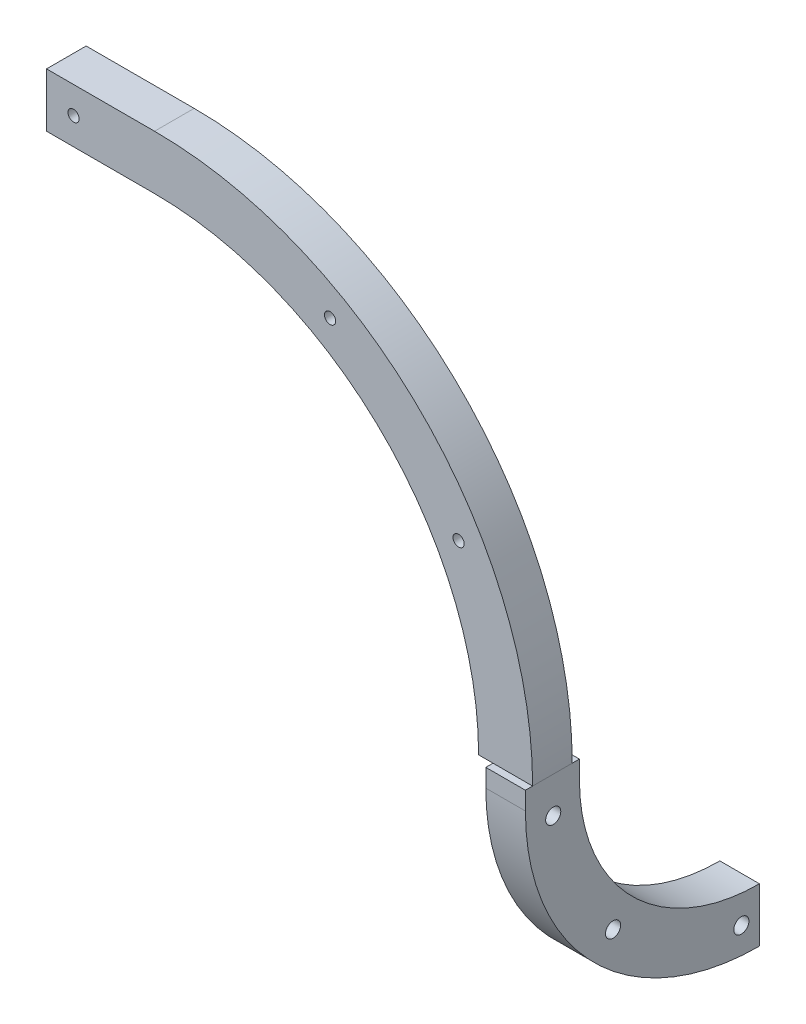
from build123d import *

# Parameters (mm, degrees)
EXTRUDE_1_DEPTH     = 15
SKETCH_2_W          = 15
SKETCH_2_H          = 15
EXTRUDE_2_DEPTH     = 5
EXTRUDE_3_DEPTH     = 15
SKETCH_4_R          = 1.55
CUT_EXTRUDE_1_DEPTH = 163.095650774
SKETCH_5_R          = 1.55
CUT_EXTRUDE_2_DEPTH = 157.68439616
CUT_EXTRUDE_START   = -2
CUT_EXTRUDE_4_DEPTH = 2
CUT_EXTRUDE_START_2 = -4
CUT_EXTRUDE_5_DEPTH = 4
CUT_EXTRUDE_6_DEPTH = 2
SKETCH_9_W          = 11
SKETCH_9_H          = 15
EXTRUDE_4_DEPTH     = 30
SKETCH_11_W         = 15
SKETCH_11_H         = 5
CUT_EXTRUDE_7_DEPTH = 4
SKETCH_12_R         = 2.1
CUT_EXTRUDE_8_DEPTH = 4.5
SKETCH_13_R         = 1.55
CUT_EXTRUDE_9_DEPTH = 162.304060705


with BuildPart() as part:
    # 草图1 → 凸台-拉伸1 (new body)
    with BuildSketch(Plane.XY):
        with BuildLine():
            Line((90, 0), (105, 0))
            ThreePointArc((105, 0), (74.246212025, 74.246212025), (0, 105))
            Line((0, 105), (0, 90))
            ThreePointArc((0, 90), (63.639610307, 63.639610307), (90, 0))
        make_face()
    extrude(amount=EXTRUDE_1_DEPTH)

    # 草图2 → 凸台-拉伸2 (add)
    with BuildSketch(Plane.XZ):
        with Locations((97.5, 7.5)):
            Rectangle(SKETCH_2_W, SKETCH_2_H)
    extrude(amount=EXTRUDE_2_DEPTH)

    # 草图3 → 凸台-拉伸3 (add)
    with BuildSketch(Plane(origin=(105, 0, 0), x_dir=(0, 0, -1), z_dir=(1, 0, 0))):
        with BuildLine():
            Line((50, -55), (50, -70))
            ThreePointArc((50, -70), (4.038059223, -50.961940777), (-15, -5))
            Line((-15, -5), (0, -5))
            ThreePointArc((0, -5), (14.644660941, -40.355339059), (50, -55))
        make_face()
    extrude(amount=-EXTRUDE_3_DEPTH)

    # 草图4 → 切除-拉伸1 (cut, through all)
    with BuildSketch(Plane.XY.offset(15)):
        with Locations((84.437476869, 48.75)):
            Circle(SKETCH_4_R)
        with Locations((48.75, 84.437476869)):
            Circle(SKETCH_4_R)
    extrude(amount=-CUT_EXTRUDE_1_DEPTH, mode=Mode.SUBTRACT)

    # 草图5 → 切除-拉伸2 (cut, through all)
    with BuildSketch(Plane(origin=(105, 0, 0), x_dir=(0, 0, -1), z_dir=(1, 0, 0))):
        with Locations((44.969401847, -62.5)):
            Circle(SKETCH_5_R)
        with Locations((9.341360082, -45.658639918)):
            Circle(SKETCH_5_R)
        with Locations((-7.28119514, -10.011455208)):
            Circle(SKETCH_5_R)
    extrude(amount=-CUT_EXTRUDE_2_DEPTH, mode=Mode.SUBTRACT)

    # 草图7 → 切除-拉伸4 (cut)
    with BuildSketch(Plane.XY.offset(15).offset(CUT_EXTRUDE_START)):
        with BuildLine():
            Line((0, 105), (0, 90))
            ThreePointArc((0, 90), (63.639610307, 63.639610307), (90, 0))
            Line((90, 0), (105, 0))
            ThreePointArc((105, 0), (74.246212025, 74.246212025), (0, 105))
        make_face()
    extrude(amount=CUT_EXTRUDE_4_DEPTH, mode=Mode.SUBTRACT)

    # 草图8 → 切除-拉伸5 (cut)
    with BuildSketch(Plane.ZY.offset(-90).offset(CUT_EXTRUDE_START_2)):
        with BuildLine():
            Line((-50, -55), (-50, -70))
            ThreePointArc((-50, -70), (-4.038059223, -50.961940777), (15, -5))
            Line((15, -5), (0, -5))
            ThreePointArc((0, -5), (-14.644660941, -40.355339059), (-50, -55))
        make_face()
    extrude(amount=CUT_EXTRUDE_5_DEPTH, mode=Mode.SUBTRACT)

    # 草图10 → 切除-拉伸6 (cut)
    with BuildSketch(Plane.XY):
        with BuildLine():
            Line((0, 105), (0, 90))
            ThreePointArc((0, 90), (63.639610307, 63.639610307), (90, 0))
            Line((90, 0), (105, 0))
            ThreePointArc((105, 0), (74.246212025, 74.246212025), (0, 105))
        make_face()
    extrude(amount=CUT_EXTRUDE_6_DEPTH, mode=Mode.SUBTRACT)

    # 草图9 → 凸台-拉伸4 (add)
    with BuildSketch(Plane.ZY):
        with Locations((7.5, 97.5)):
            Rectangle(SKETCH_9_W, SKETCH_9_H)
    extrude(amount=EXTRUDE_4_DEPTH)

    # 草图11 → 切除-拉伸7 (cut)
    with BuildSketch(Plane.ZY.offset(-90)):
        with Locations((7.5, -2.5)):
            Rectangle(SKETCH_11_W, SKETCH_11_H)
    extrude(amount=-CUT_EXTRUDE_7_DEPTH, mode=Mode.SUBTRACT)

    # 草图12 → 切除-拉伸8 (cut)
    with BuildSketch(Plane(origin=(105, 0, 0), x_dir=(0, 0, -1), z_dir=(1, 0, 0))):
        with Locations((-7.28119514, -10.011455208)):
            Circle(SKETCH_12_R)
        with Locations((9.341360082, -45.658639918)):
            Circle(SKETCH_12_R)
        with Locations((44.969401847, -62.5)):
            Circle(SKETCH_12_R)
    extrude(amount=-CUT_EXTRUDE_8_DEPTH, mode=Mode.SUBTRACT)

    # 草图13 → 切除-拉伸9 (cut, through all)
    with BuildSketch(Plane.XY.offset(13)):
        with Locations((-22.5, 97.5)):
            Circle(SKETCH_13_R)
    extrude(amount=-CUT_EXTRUDE_9_DEPTH, mode=Mode.SUBTRACT)


solid = part.part
